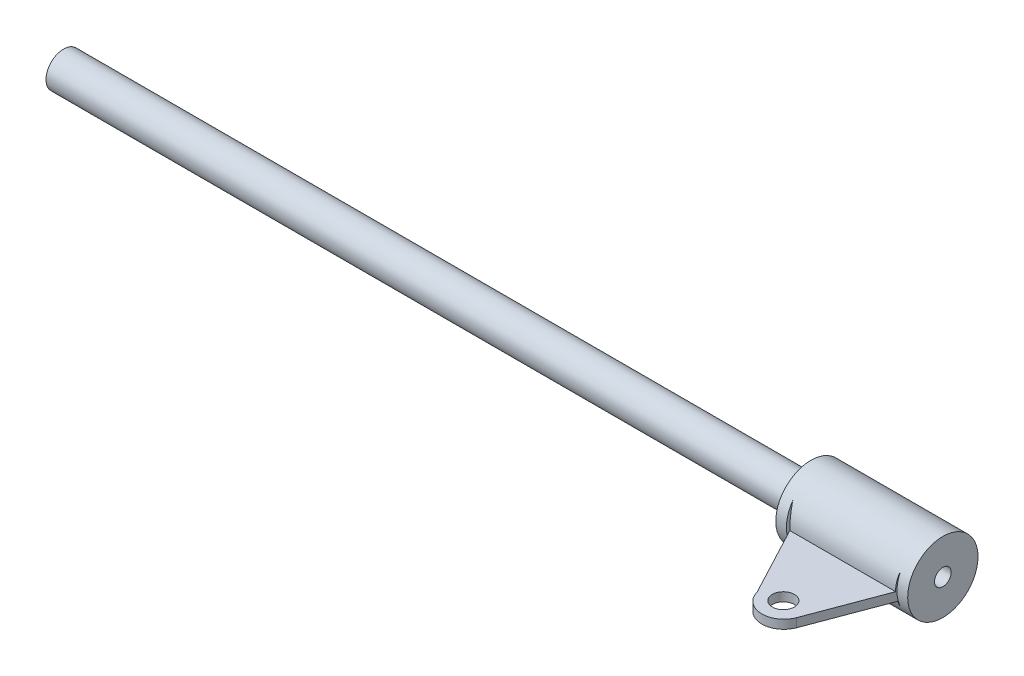
from build123d import *

# Parameters (mm, degrees)
SKETCH8_W               = 245.440082446
SKETCH8_H               = 20
BOSS_EXTRUDE1_DEPTH     = 400
CUT_EXTRUDE8_DEPTH      = 1704.211489704
CUT_EXTRUDE8_DEPTH_BACK = 1704.211489704
SKETCH9_R               = 25
CUT_EXTRUDE9_DEPTH      = 1679.423730942
CUT_EXTRUDE9_DEPTH_BACK = 1679.423730942
SKETCH10_R              = 19.05


with BuildPart() as part:
    # Sketch2 → Revolve1 (revolve)
    with BuildSketch(Plane.XY, mode=Mode.PRIVATE) as revolve1_sk:
        Polygon((1650, -24.245152355), (1350, -24.245152355), (1350, 15.754847645), (-350, 15.754847645), (-350, 55.754847645), (1650, 55.754847645), align=None)
    revolve(revolve1_sk.sketch.rotate(Axis((1650, 55.754847645, 0), (-1, 0, 0)), 180), axis=Axis((1650, 55.754847645, 0), (-1, 0, 0)))

    # Sketch8 → Boss-Extrude1 (add)
    with BuildSketch(Plane.XY):
        with Locations((1502.581339025, 43.148524262)):
            Rectangle(SKETCH8_W, SKETCH8_H)
    extrude(amount=BOSS_EXTRUDE1_DEPTH)

    # Sketch9 → Cut-Extrude8 (cut, two sides: drawn at the far end of the back side and taken through both)
    with BuildSketch(Plane(origin=(0, 0, 0), x_dir=(1, 0, 0), z_dir=(0, 1, 0)).offset(-CUT_EXTRUDE8_DEPTH_BACK)):
        with BuildLine():
            ThreePointArc((1561.210933041, -243.569878217), (1523.352220911, -275.193400776), (1476.779097647, -258.936911225))
            ThreePointArc((1476.779097647, -258.936911225), (1470.218517898, -249.41265784), (1466.021642395, -238.635884427))
            Line((1466.021642395, -238.635884427), (1374.277655751, -65.500408808))
            Line((1374.277655751, -65.500408808), (1374.277655751, -447.060346657))
            Line((1374.277655751, -447.060346657), (1625.633642708, -447.060346657))
            Line((1625.633642708, -447.060346657), (1625.633642708, -71.911854778))
            Line((1625.633642708, -71.911854778), (1561.210933041, -243.569878217))
        make_face()
        with Locations(Location((1512.641248766, -225.471244951, 0), (0, 0, 270))):
            Circle(SKETCH9_R)
    extrude(amount=CUT_EXTRUDE8_DEPTH + CUT_EXTRUDE8_DEPTH_BACK, mode=Mode.SUBTRACT)

    # Sketch10 → Cut-Extrude9 (cut, two sides: drawn at the far end of the back side and taken through both)
    with BuildSketch(Plane(origin=(0, 0, 0), x_dir=(0, 0, -1), z_dir=(1, 0, 0)).offset(-CUT_EXTRUDE9_DEPTH_BACK)):
        with Locations((0, 55.754847645)):
            Circle(SKETCH10_R)
    extrude(amount=CUT_EXTRUDE9_DEPTH + CUT_EXTRUDE9_DEPTH_BACK, mode=Mode.SUBTRACT)


solid = part.part
